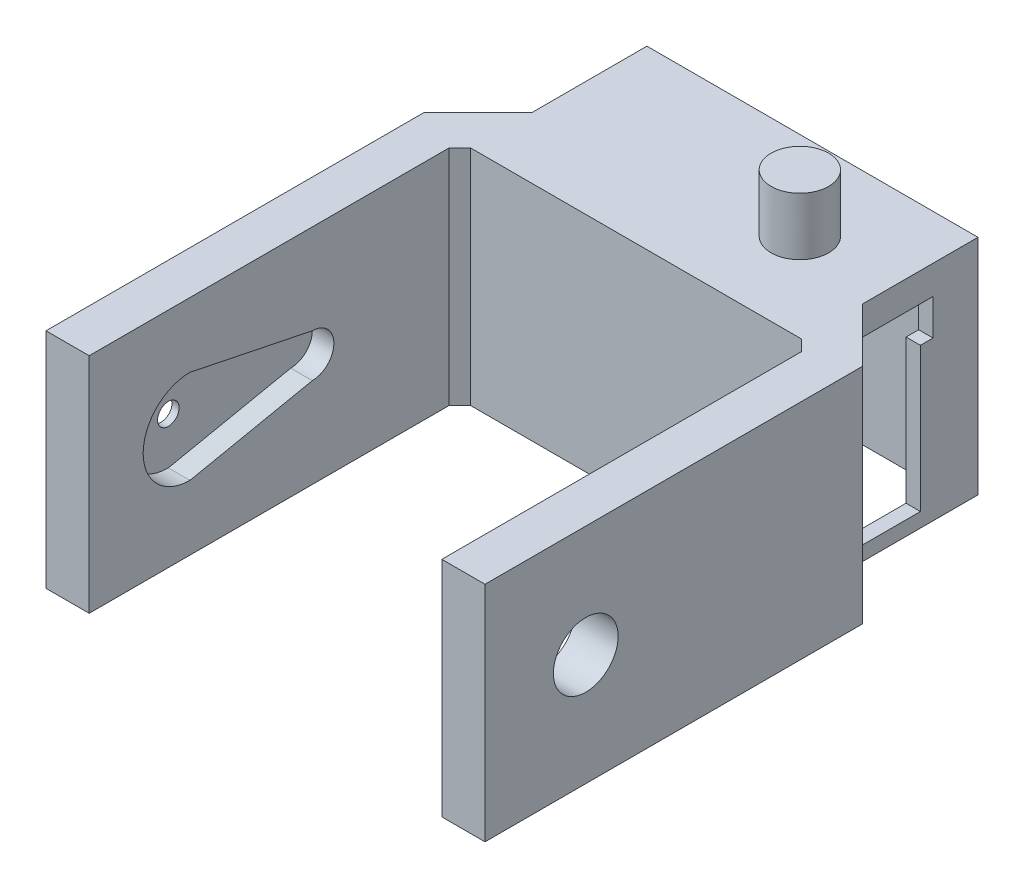
from build123d import *

# Parameters (mm, degrees)
SKETCH1_W               = 46
SKETCH1_H               = 24.5
BODY_DEPTH              = 31
SKETCH3_W               = 42
SKETCH3_H               = 20.5
SERVO_HOLE_DEPTH        = 29
SKETCH6_R               = 4
BOSS_EXTRUDE3_DEPTH     = 8
BOSS_EXTRUDE4_DEPTH     = 31
CUT_EXTRUDE3_DEPTH      = 2
CUT_EXTRUDE3_DEPTH_BACK = 29
CUT_EXTRUDE4_DEPTH      = 3
CUT_EXTRUDE5_DEPTH      = 93.790422458
CUT_EXTRUDE5_DEPTH_BACK = 93.790422458
SKETCH11_R              = 1.5
SKETCH12_R              = 4.5
CUT_EXTRUDE6_DEPTH      = 6
SKETCH13_R              = 5
CUT_EXTRUDE7_DEPTH      = 2


with BuildPart() as part:
    # Sketch1 → Body (new body)
    with BuildSketch(Plane(origin=(0, 0, 0), x_dir=(1, 0, 0), z_dir=(0, 1, 0))):
        Rectangle(SKETCH1_W, SKETCH1_H)
    extrude(amount=BODY_DEPTH)

    # Sketch3 → Servo Hole (cut)
    with BuildSketch(Plane(origin=(0, 0, 0), x_dir=(1, 0, 0), z_dir=(0, 1, 0))):
        Rectangle(SKETCH3_W, SKETCH3_H)
    extrude(amount=SERVO_HOLE_DEPTH, mode=Mode.SUBTRACT)

    # Sketch6 → Boss-Extrude3 (add)
    with BuildSketch(Plane(origin=(0, 31, 0), x_dir=(1, 0, 0), z_dir=(0, 1, 0))):
        with Locations(Location((10.5, 0, 0), (0, 0, 90))):
            Circle(SKETCH6_R)
    extrude(amount=BOSS_EXTRUDE3_DEPTH)

    # Sketch8 → Boss-Extrude4 (add)
    with BuildSketch(Plane.XZ):
        Polygon((-23, 12.25), (-24.5, 13.75), (-24.5, 63.75), (-30.5, 63.75), (-30.5, 11.264718626), (-23, 3.764718626), align=None)
        Polygon((24.5, 63.75), (24.5, 13.75), (23, 12.25), (23, 3.764718626), (30.5, 11.264718626), (30.5, 63.75), align=None)
    extrude(amount=-BOSS_EXTRUDE4_DEPTH)

    # Sketch5 → Cut-Extrude3 (cut, two sides: drawn at the far end of the back side and taken through both)
    with BuildSketch(Plane.ZY.offset(-23).offset(-CUT_EXTRUDE3_DEPTH_BACK)):
        Polygon((-6, 27), (6, 27), (6, 22), (4.25, 22), (4.25, 2), (-4.25, 2), (-4.25, 22), (-6, 22), align=None)
    extrude(amount=CUT_EXTRUDE3_DEPTH + CUT_EXTRUDE3_DEPTH_BACK, mode=Mode.SUBTRACT)

    # Sketch10 → Cut-Extrude4 (cut)
    with BuildSketch(Plane(origin=(-24.5, 0, 0), x_dir=(0, 0, -1), z_dir=(1, 0, 0))):
        with BuildLine():
            Line((-32.75, 12.5), (-49.75, 9))
            ThreePointArc((-49.75, 9), (-56.25, 15.5), (-49.75, 22))
            Line((-49.75, 22), (-32.75, 18.5))
            ThreePointArc((-32.75, 18.5), (-29.75, 15.5), (-32.75, 12.5))
        make_face()
    extrude(amount=-CUT_EXTRUDE4_DEPTH, mode=Mode.SUBTRACT)

    # Sketch11 → Cut-Extrude5 (cut, two sides: drawn at the far end of the back side and taken through both)
    with BuildSketch(Plane(origin=(-24.5, 0, 0), x_dir=(0, 0, -1), z_dir=(1, 0, 0)).offset(-CUT_EXTRUDE5_DEPTH_BACK)):
        with Locations((-49.75, 15.5)):
            Circle(SKETCH11_R)
    extrude(amount=CUT_EXTRUDE5_DEPTH + CUT_EXTRUDE5_DEPTH_BACK, mode=Mode.SUBTRACT)

    # Sketch12 → Cut-Extrude6 (cut)
    with BuildSketch(Plane(origin=(30.5, 0, 0), x_dir=(0, 0, -1), z_dir=(1, 0, 0))):
        with Locations((-49.75, 15.5)):
            Circle(SKETCH12_R)
    extrude(amount=-CUT_EXTRUDE6_DEPTH, mode=Mode.SUBTRACT)

    # Sketch13 → Cut-Extrude7 (cut)
    with BuildSketch(Plane.ZY.offset(30.5)):
        with Locations((49.75, 15.5)):
            Circle(SKETCH13_R)
    extrude(amount=-CUT_EXTRUDE7_DEPTH, mode=Mode.SUBTRACT)


solid = part.part
